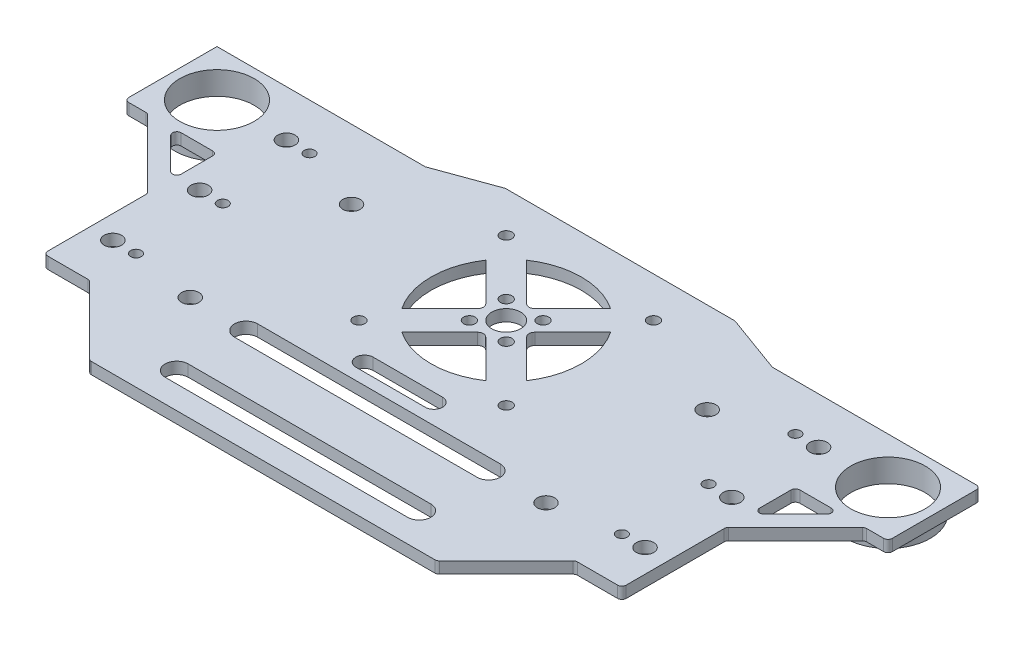
from build123d import *
from build123d.topology import SkipClean

# Parameters (mm, degrees)
SKETCH_1_R      = 1.5
SKETCH_1_R_2    = 0.925
SKETCH_1_R_3    = 1
SKETCH_1_R_4    = 15
SKETCH_1_R_5    = 2.5
SKETCH_1_R_6    = 6.425
EXTRUDE_1_DEPTH = 2
FILLET_1_R      = 0.75
EXTRUDE_START   = 2
SKETCH_3_R      = 7.3
SKETCH_3_R_2    = 6.425
EXTRUDE_2_DEPTH = 2


with BuildPart() as part:
    # 草图1 → 凸台-拉伸1 (new body)
    # profile 1 of 11: a face of its own
    with BuildSketch(Plane(origin=(0, 0, 0), x_dir=(1, 0, 0), z_dir=(0, 1, 0))):
        Polygon((-19.848034865, 26.695013128), (-30, 23), (30, 23), (19.848034865, 26.695013128), (0, 26.695013128), align=None)
    # profile 2 of 11: a face of its own
    with BuildSketch(Plane(origin=(0, 0, 0), x_dir=(1, 0, 0), z_dir=(0, 1, 0))):
        Polygon((-19.848034865, 26.695013128), (-30, 23), (30, 23), (19.848034865, 26.695013128), (0, 26.695013128), align=None)
    # profile 3 of 11: a face of its own
    with BuildSketch(Plane(origin=(0, 0, 0), x_dir=(1, 0, 0), z_dir=(0, 1, 0))):
        Polygon((-30, 23), (-50, 23), (-50, 7), (-50, -1), (-50, -5), (-50, -23), (-42, -23), (42, -23), (50, -23), (50, -5), (50, -1), (50, 7), (50, 23), (30, 23), align=None)
        with Locations(Location((-46, -15, 0), (0, 0, 270))):
            Circle(SKETCH_1_R, mode=Mode.SUBTRACT)
        with Locations(Location((-42, -15, 0), (0, 0, 270))):
            Circle(SKETCH_1_R_2, mode=Mode.SUBTRACT)
        with Locations(Location((-30.7465, -16.87, 0), (0, 0, 90))):
            Circle(SKETCH_1_R, mode=Mode.SUBTRACT)
        with Locations(Location((-12.727922061, -5.727922061, 0), (0, 0, 270))):
            Circle(SKETCH_1_R_3, mode=Mode.SUBTRACT)
        with BuildLine():
            ThreePointArc((-20.969611628, -19), (-22.969611628, -17), (-20.969611628, -15))
            Line((-20.969611628, -15), (20.969611628, -15))
            ThreePointArc((20.969611628, -15), (22.969611628, -17), (20.969611628, -19))
            Line((20.969611628, -19), (-20.969611628, -19))
        make_face(mode=Mode.SUBTRACT)
        with Locations(Location((30.7465, -16.87, 0), (0, 0, 270))):
            Circle(SKETCH_1_R, mode=Mode.SUBTRACT)
        with BuildLine():
            ThreePointArc((-6, -13), (-7.5, -11.5), (-6, -10))
            Line((-6, -10), (6, -10))
            ThreePointArc((6, -10), (7.5, -11.5), (6, -13))
            Line((6, -13), (-6, -13))
        make_face(mode=Mode.SUBTRACT)
        with Locations(Location((12.727922061, -5.727922061, 0), (0, 0, 270))):
            Circle(SKETCH_1_R_3, mode=Mode.SUBTRACT)
        with Locations(Location((42, -15, 0), (0, 0, 270))):
            Circle(SKETCH_1_R_2, mode=Mode.SUBTRACT)
        with Locations(Location((46, -15, 0), (0, 0, 270))):
            Circle(SKETCH_1_R, mode=Mode.SUBTRACT)
        with Locations(Location((-46, 0, 0), (0, 0, 270))):
            Circle(SKETCH_1_R, mode=Mode.SUBTRACT)
        with Locations(Location((-42, 0, 0), (0, 0, 270))):
            Circle(SKETCH_1_R_2, mode=Mode.SUBTRACT)
        with Locations(Location((-30.7465, 11, 0), (0, 0, 270))):
            Circle(SKETCH_1_R, mode=Mode.SUBTRACT)
        with Locations(Location((-46, 15, 0), (0, 0, 270))):
            Circle(SKETCH_1_R, mode=Mode.SUBTRACT)
        with Locations(Location((-42, 15, 0), (0, 0, 270))):
            Circle(SKETCH_1_R_2, mode=Mode.SUBTRACT)
        with Locations(Location((-12.727922061, 19.727922061, 0), (0, 0, 270))):
            Circle(SKETCH_1_R_3, mode=Mode.SUBTRACT)
        with Locations((0, 7)):
            Circle(SKETCH_1_R_4, mode=Mode.SUBTRACT)
        with Locations(Location((30.7465, 11, 0), (0, 0, 270))):
            Circle(SKETCH_1_R, mode=Mode.SUBTRACT)
        with Locations(Location((42, 0, 0), (0, 0, 270))):
            Circle(SKETCH_1_R_2, mode=Mode.SUBTRACT)
        with Locations(Location((46, 0, 0), (0, 0, 270))):
            Circle(SKETCH_1_R, mode=Mode.SUBTRACT)
        with Locations(Location((12.727922061, 19.727922061, 0), (0, 0, 270))):
            Circle(SKETCH_1_R_3, mode=Mode.SUBTRACT)
        with Locations(Location((42, 15, 0), (0, 0, 270))):
            Circle(SKETCH_1_R_2, mode=Mode.SUBTRACT)
        with Locations(Location((46, 15, 0), (0, 0, 270))):
            Circle(SKETCH_1_R, mode=Mode.SUBTRACT)
    # profile 4 of 11: a face of its own
    with BuildSketch(Plane(origin=(0, 0, 0), x_dir=(1, 0, 0), z_dir=(0, 1, 0))):
        Polygon((-30, 23), (-50, 23), (-50, 7), (-50, -1), (-50, -5), (-50, -23), (-42, -23), (42, -23), (50, -23), (50, -5), (50, -1), (50, 7), (50, 23), (30, 23), align=None)
        with Locations(Location((-46, -15, 0), (0, 0, 270))):
            Circle(SKETCH_1_R, mode=Mode.SUBTRACT)
        with Locations(Location((-42, -15, 0), (0, 0, 270))):
            Circle(SKETCH_1_R_2, mode=Mode.SUBTRACT)
        with Locations(Location((-30.7465, -16.87, 0), (0, 0, 90))):
            Circle(SKETCH_1_R, mode=Mode.SUBTRACT)
        with Locations(Location((-12.727922061, -5.727922061, 0), (0, 0, 270))):
            Circle(SKETCH_1_R_3, mode=Mode.SUBTRACT)
        with BuildLine():
            ThreePointArc((-20.969611628, -19), (-22.969611628, -17), (-20.969611628, -15))
            Line((-20.969611628, -15), (20.969611628, -15))
            ThreePointArc((20.969611628, -15), (22.969611628, -17), (20.969611628, -19))
            Line((20.969611628, -19), (-20.969611628, -19))
        make_face(mode=Mode.SUBTRACT)
        with Locations(Location((30.7465, -16.87, 0), (0, 0, 270))):
            Circle(SKETCH_1_R, mode=Mode.SUBTRACT)
        with BuildLine():
            ThreePointArc((-6, -13), (-7.5, -11.5), (-6, -10))
            Line((-6, -10), (6, -10))
            ThreePointArc((6, -10), (7.5, -11.5), (6, -13))
            Line((6, -13), (-6, -13))
        make_face(mode=Mode.SUBTRACT)
        with Locations(Location((12.727922061, -5.727922061, 0), (0, 0, 270))):
            Circle(SKETCH_1_R_3, mode=Mode.SUBTRACT)
        with Locations(Location((42, -15, 0), (0, 0, 270))):
            Circle(SKETCH_1_R_2, mode=Mode.SUBTRACT)
        with Locations(Location((46, -15, 0), (0, 0, 270))):
            Circle(SKETCH_1_R, mode=Mode.SUBTRACT)
        with Locations(Location((-46, 0, 0), (0, 0, 270))):
            Circle(SKETCH_1_R, mode=Mode.SUBTRACT)
        with Locations(Location((-42, 0, 0), (0, 0, 270))):
            Circle(SKETCH_1_R_2, mode=Mode.SUBTRACT)
        with Locations(Location((-30.7465, 11, 0), (0, 0, 270))):
            Circle(SKETCH_1_R, mode=Mode.SUBTRACT)
        with Locations(Location((-46, 15, 0), (0, 0, 270))):
            Circle(SKETCH_1_R, mode=Mode.SUBTRACT)
        with Locations(Location((-42, 15, 0), (0, 0, 270))):
            Circle(SKETCH_1_R_2, mode=Mode.SUBTRACT)
        with Locations(Location((-12.727922061, 19.727922061, 0), (0, 0, 270))):
            Circle(SKETCH_1_R_3, mode=Mode.SUBTRACT)
        with Locations((0, 7)):
            Circle(SKETCH_1_R_4, mode=Mode.SUBTRACT)
        with Locations(Location((30.7465, 11, 0), (0, 0, 270))):
            Circle(SKETCH_1_R, mode=Mode.SUBTRACT)
        with Locations(Location((42, 0, 0), (0, 0, 270))):
            Circle(SKETCH_1_R_2, mode=Mode.SUBTRACT)
        with Locations(Location((46, 0, 0), (0, 0, 270))):
            Circle(SKETCH_1_R, mode=Mode.SUBTRACT)
        with Locations(Location((12.727922061, 19.727922061, 0), (0, 0, 270))):
            Circle(SKETCH_1_R_3, mode=Mode.SUBTRACT)
        with Locations(Location((42, 15, 0), (0, 0, 270))):
            Circle(SKETCH_1_R_2, mode=Mode.SUBTRACT)
        with Locations(Location((46, 15, 0), (0, 0, 270))):
            Circle(SKETCH_1_R, mode=Mode.SUBTRACT)
    # profile 5 of 11: a face of its own
    with BuildSketch(Plane(origin=(0, 0, 0), x_dir=(1, 0, 0), z_dir=(0, 1, 0))):
        with Locations((0, 7)):
            Circle(SKETCH_1_R_4)
        with BuildLine():
            ThreePointArc((13, 7), (12.434860091, 3.208660592), (10.788576229, -0.253042323))
            ThreePointArc((10.788576229, -0.253042323), (9.192388155, -2.192388155), (7.253042323, -3.788576229))
            ThreePointArc((7.253042323, -3.788576229), (0, -6), (-7.253042323, -3.788576229))
            ThreePointArc((-7.253042323, -3.788576229), (-9.192388155, -2.192388155), (-10.788576229, -0.253042323))
            ThreePointArc((-10.788576229, -0.253042323), (-13, 7), (-10.788576229, 14.253042323))
            ThreePointArc((-10.788576229, 14.253042323), (-9.192388155, 16.192388155), (-7.253042323, 17.788576229))
            ThreePointArc((-7.253042323, 17.788576229), (0, 20), (7.253042323, 17.788576229))
            ThreePointArc((7.253042323, 17.788576229), (9.192388155, 16.192388155), (10.788576229, 14.253042323))
            ThreePointArc((10.788576229, 14.253042323), (12.434860091, 10.791339408), (13, 7))
        make_face(mode=Mode.SUBTRACT)
    # profile 6 of 11: a face of its own
    with BuildSketch(Plane(origin=(0, 0, 0), x_dir=(1, 0, 0), z_dir=(0, 1, 0))):
        with BuildLine():
            ThreePointArc((7.253042323, -3.788576229), (9.192388155, -2.192388155), (10.788576229, -0.253042323))
            Line((10.788576229, -0.253042323), (4.242640687, 6.292893219))
            ThreePointArc((4.242640687, 6.292893219), (3.949747468, 7), (4.242640687, 7.707106781))
            Line((4.242640687, 7.707106781), (10.788576229, 14.253042323))
            ThreePointArc((10.788576229, 14.253042323), (9.192388155, 16.192388155), (7.253042323, 17.788576229))
            Line((7.253042323, 17.788576229), (0.707106781, 11.242640687))
            ThreePointArc((0.707106781, 11.242640687), (0, 10.949747468), (-0.707106781, 11.242640687))
            Line((-0.707106781, 11.242640687), (-7.253042323, 17.788576229))
            ThreePointArc((-7.253042323, 17.788576229), (-9.192388155, 16.192388155), (-10.788576229, 14.253042323))
            Line((-10.788576229, 14.253042323), (-4.242640687, 7.707106781))
            ThreePointArc((-4.242640687, 7.707106781), (-3.949747468, 7), (-4.242640687, 6.292893219))
            Line((-4.242640687, 6.292893219), (-10.788576229, -0.253042323))
            ThreePointArc((-10.788576229, -0.253042323), (-9.192388155, -2.192388155), (-7.253042323, -3.788576229))
            Line((-7.253042323, -3.788576229), (-0.707106781, 2.757359313))
            ThreePointArc((-0.707106781, 2.757359313), (0, 3.050252532), (0.707106781, 2.757359313))
            Line((0.707106781, 2.757359313), (7.253042323, -3.788576229))
        make_face()
        with Locations(Location((-3.181980515, 3.818019485, 0), (0, 0, 270))):
            Circle(SKETCH_1_R_3, mode=Mode.SUBTRACT)
        with Locations(Location((-3.181980515, 10.181980515, 0), (0, 0, 270))):
            Circle(SKETCH_1_R_3, mode=Mode.SUBTRACT)
        with Locations(Location((3.181980515, 3.818019485, 0), (0, 0, 270))):
            Circle(SKETCH_1_R_3, mode=Mode.SUBTRACT)
        with Locations(Location((0, 7, 0), (0, 0, 270))):
            Circle(SKETCH_1_R_5, mode=Mode.SUBTRACT)
        with Locations(Location((3.181980515, 10.181980515, 0), (0, 0, 270))):
            Circle(SKETCH_1_R_3, mode=Mode.SUBTRACT)
    # profile 7 of 11: a face of its own
    with BuildSketch(Plane(origin=(0, 0, 0), x_dir=(1, 0, 0), z_dir=(0, 1, 0))):
        Polygon((42, -23), (-42, -23), (-30, -35), (30, -35), align=None)
        with BuildLine():
            ThreePointArc((-20.969611628, -31), (-22.969611628, -29), (-20.969611628, -27))
            Line((-20.969611628, -27), (20.969611628, -27))
            ThreePointArc((20.969611628, -27), (22.969611628, -29), (20.969611628, -31))
            Line((20.969611628, -31), (-20.969611628, -31))
        make_face(mode=Mode.SUBTRACT)
    # profile 8 of 11: a face of its own
    with BuildSketch(Plane(origin=(0, 0, 0), x_dir=(1, 0, 0), z_dir=(0, 1, 0))):
        Polygon((-50, -5), (-50, -1), (-58, 7), (-62, 7), align=None)
    # profile 9 of 11: a face of its own
    with BuildSketch(Plane(origin=(0, 0, 0), x_dir=(1, 0, 0), z_dir=(0, 1, 0))):
        Polygon((-50, 7), (-50, 23), (-66, 23), (-66, 7), (-62, 7), (-58, 7), align=None)
        with Locations(Location((-58, 15, 0), (0, 0, 270))):
            Circle(SKETCH_1_R_6, mode=Mode.SUBTRACT)
    # profile 10 of 11: a face of its own
    with BuildSketch(Plane(origin=(0, 0, 0), x_dir=(1, 0, 0), z_dir=(0, 1, 0))):
        Polygon((66, 23), (50, 23), (50, 7), (58, 7), (62, 7), (66, 7), align=None)
        with Locations(Location((58, 15, 0), (0, 0, 270))):
            Circle(SKETCH_1_R_6, mode=Mode.SUBTRACT)
    # profile 11 of 11: a face of its own
    with BuildSketch(Plane(origin=(0, 0, 0), x_dir=(1, 0, 0), z_dir=(0, 1, 0))):
        Polygon((58, 7), (50, -1), (50, -5), (62, 7), align=None)
    extrude(amount=EXTRUDE_1_DEPTH)

    # 圆角1
    fillet_1_edges = [part.edges().sort_by_distance(p)[0] for p in [
        (66, 1, -23),
        (66, 1, -7),
        (62, 1, -7),
        (50, 1, 5),
        (50, 1, 23),
        (42, 1, 23),
        (30, 1, 35),
        (-30, 1, 35),
        (-42, 1, 23),
        (-50, 1, 23),
        (-50, 1, 5),
        (-62, 1, -7),
        (-66, 1, -7),
        (50, 1, -7),
        (50, 1, 1),
        (58, 1, -7),
        (-50, 1, 1),
        (-50, 1, -7),
        (-58, 1, -7),
    ]]
    fillet(fillet_1_edges, radius=FILLET_1_R)

    # 草图3 → 凸台-拉伸2 (add)
    # profile 1 of 2: a face of its own
    with SkipClean():  # the faces are left unmerged after this step: merging them gives an invalid solid
        with BuildSketch(Plane.XZ.offset(EXTRUDE_START)):
            with Locations(Location((-58, -15, 0), (0, 0, 90))):
                Circle(SKETCH_3_R)
            with Locations(Location((-58, -15, 0), (0, 0, 270))):
                Circle(SKETCH_3_R_2, mode=Mode.SUBTRACT)
        # profile 2 of 2: a face of its own
        with BuildSketch(Plane.XZ.offset(EXTRUDE_START)):
            with Locations(Location((58, -15, 0), (0, 0, 90))):
                Circle(SKETCH_3_R)
            with Locations(Location((58, -15, 0), (0, 0, 90))):
                Circle(SKETCH_3_R_2, mode=Mode.SUBTRACT)
        extrude(amount=-EXTRUDE_2_DEPTH)


solid = part.part
